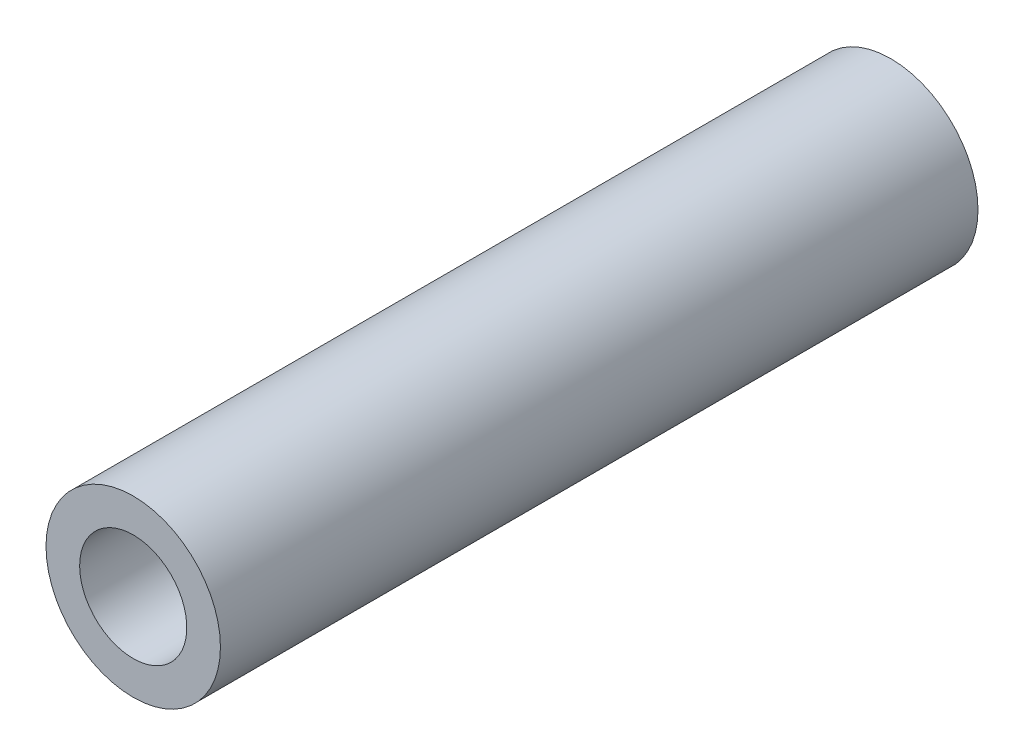
from build123d import *

# Parameters (mm, degrees)
SKETCH_1_R      = 3.5
SKETCH_1_R_2    = 2.15
EXTRUDE_1_DEPTH = 30.4


with BuildPart() as part:
    # 草图1 → 凸台-拉伸1 (new body)
    with BuildSketch(Plane.XY):
        with Locations(Location((0, 0, 0), (0, 0, 180))):
            Circle(SKETCH_1_R)
        with Locations(Location((0, 0, 0), (0, 0, 180))):
            Circle(SKETCH_1_R_2, mode=Mode.SUBTRACT)
    extrude(amount=EXTRUDE_1_DEPTH)


solid = part.part
